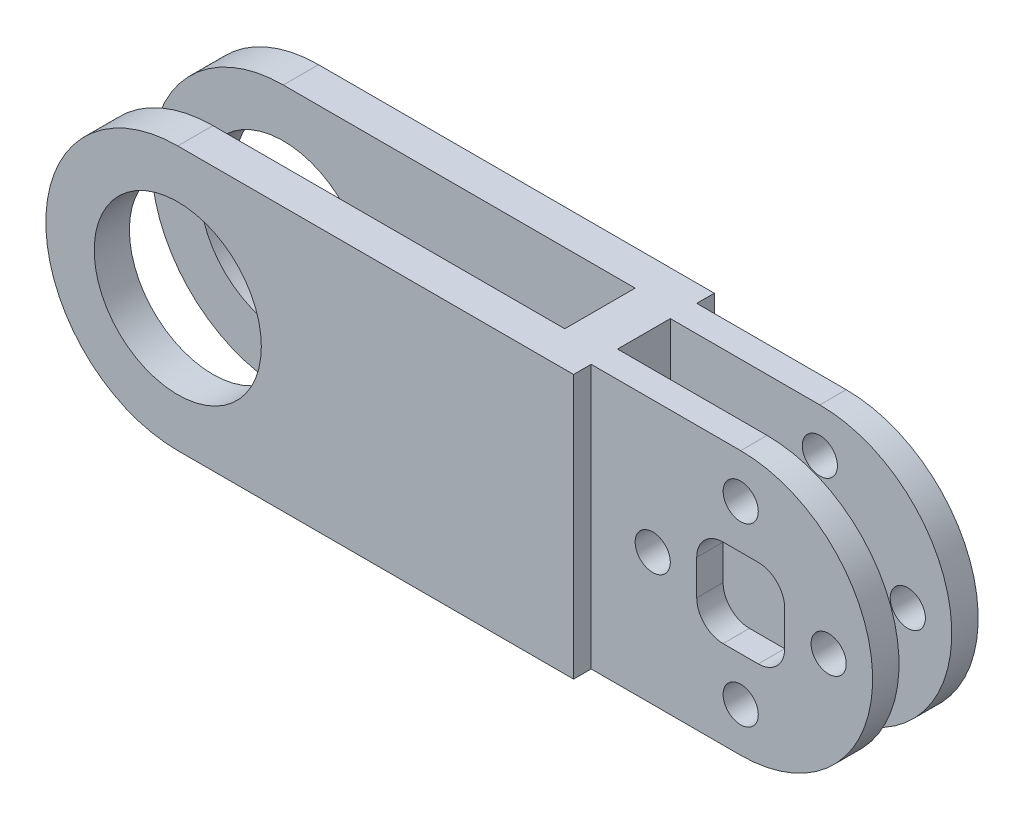
from build123d import *

# Parameters (mm, degrees)
EXTRUDE_1_DEPTH          = 16
SKETCH_2_R               = 9.5
SKETCH_2_R_2             = 2
SKETCH_2_W               = 10
SKETCH_2_H               = 10
CUT_EXTRUDE_1_DEPTH      = 16
FILLET_1_R               = 3
CUT_EXTRUDE_5_DEPTH      = 15
CUT_EXTRUDE_5_DEPTH_BACK = 15
SKETCH_4_W               = 55
SKETCH_4_H               = 8
CUT_EXTRUDE_6_DEPTH      = 15
CUT_EXTRUDE_6_DEPTH_BACK = 15
SKETCH_5_W               = 32
SKETCH_5_H               = 2


with BuildPart() as part:
    # 草图1 → 凸台-拉伸1 (new body)
    with BuildSketch(Plane.XY):
        with BuildLine():
            Line((0, 15), (62, 15))
            ThreePointArc((62, 15), (77, 0), (62, -15))
            Line((62, -15), (0, -15))
            ThreePointArc((0, -15), (-15, 0), (0, 15))
        make_face()
    extrude(amount=EXTRUDE_1_DEPTH)

    # 草图2 → 切除-拉伸1 (cut)
    with BuildSketch(Plane.XY.offset(16)):
        Circle(SKETCH_2_R)
        with Locations((62, 10)):
            Circle(SKETCH_2_R_2)
        with Locations((72, 0)):
            Circle(SKETCH_2_R_2)
        with Locations((62, -10)):
            Circle(SKETCH_2_R_2)
        with Locations((52, 0)):
            Circle(SKETCH_2_R_2)
        with Locations((62, 0)):
            Rectangle(SKETCH_2_W, SKETCH_2_H)
    extrude(amount=-CUT_EXTRUDE_1_DEPTH, mode=Mode.SUBTRACT)

    # 圆角1
    fillet_1_edges = [part.edges().sort_by_distance(p)[0] for p in [
        (67, 5, 8),
        (67, -5, 8),
        (57, -5, 8),
        (57, 5, 8),
    ]]
    fillet(fillet_1_edges, radius=FILLET_1_R)

    # 草图4 → 切除-拉伸5 (cut, two sides: drawn at the far end of the back side and taken through both)
    with BuildSketch(Plane(origin=(0, 0, 0), x_dir=(1, 0, 0), z_dir=(0, 1, 0)).offset(-CUT_EXTRUDE_5_DEPTH_BACK)):
        with Locations((12.5, -8)):
            Rectangle(SKETCH_4_W, SKETCH_4_H)
    extrude(amount=CUT_EXTRUDE_5_DEPTH + CUT_EXTRUDE_5_DEPTH_BACK, mode=Mode.SUBTRACT)

    # 草图5 → 切除-拉伸6 (cut, two sides: drawn at the far end of the back side and taken through both)
    with BuildSketch(Plane(origin=(0, 0, 0), x_dir=(1, 0, 0), z_dir=(0, 1, 0)).offset(-CUT_EXTRUDE_6_DEPTH_BACK)):
        Polygon((45, -8), (45, -11), (77, -11), (77, -5), (45, -5), align=None)
        with Locations((61, -1)):
            Rectangle(SKETCH_5_W, SKETCH_5_H)
        with Locations((61, -15)):
            Rectangle(SKETCH_5_W, SKETCH_5_H)
    extrude(amount=CUT_EXTRUDE_6_DEPTH + CUT_EXTRUDE_6_DEPTH_BACK, mode=Mode.SUBTRACT)


solid = part.part
